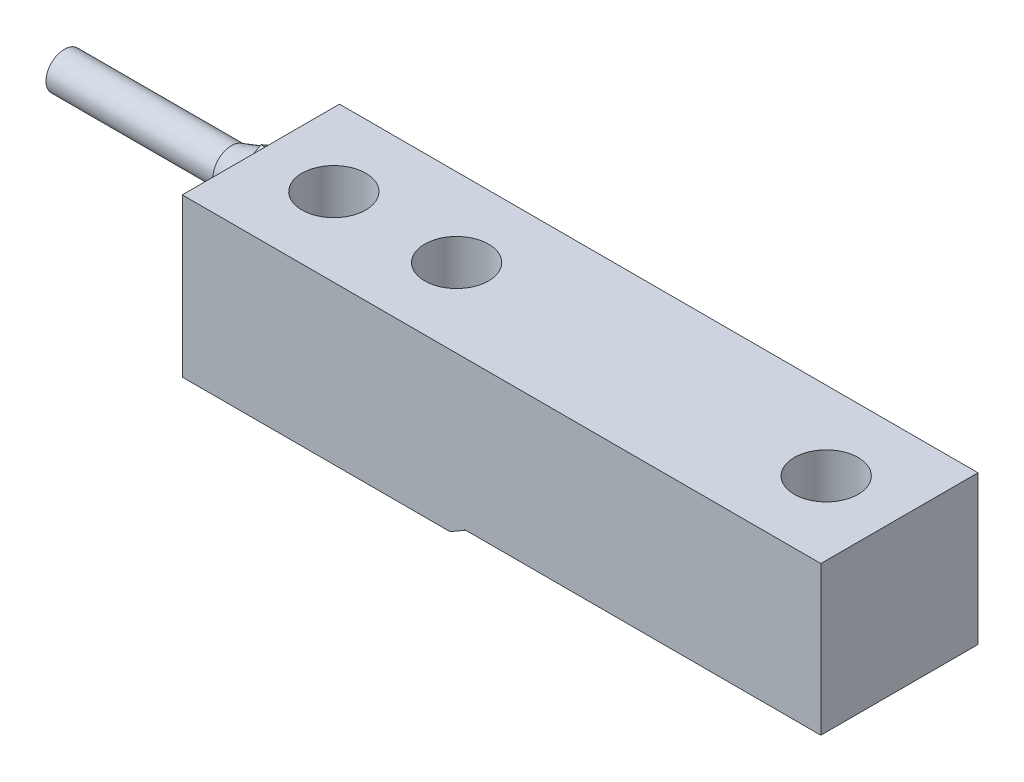
from build123d import *

# Parameters (mm, degrees)
SKETCH1_W                     = 130
SKETCH1_H                     = 32
BOSS_EXTRUDE1_DEPTH           = 32.131
SKETCH2_R                     = 6.5
CUT_EXTRUDE1_DEPTH            = 138.68224708
SKETCH3_R                     = 6.5
CUT_EXTRUDE2_DEPTH            = 12
TAP_DRILL_FOR_M12X1_75_TAP1_D = 10.2
CUT_EXTRUDE3_START            = -32.131
SKETCH10_W                    = 72.5
SKETCH10_H                    = 32
CUT_EXTRUDE3_DEPTH            = 1.85
CHAMFER1_SIZE                 = 3
CHAMFER1_SIZE2                = 1.732050808
BOSS_EXTRUDE2_DEPTH           = 10
SKETCH13_W                    = 1
SKETCH13_H                    = 1


with BuildPart() as part:
    # Sketch1 → Boss-Extrude1 (new body)
    with BuildSketch(Plane(origin=(0, 0, 0), x_dir=(1, 0, 0), z_dir=(0, 1, 0))):
        with Locations((65, 16)):
            Rectangle(SKETCH1_W, SKETCH1_H)
    extrude(amount=BOSS_EXTRUDE1_DEPTH)

    # Sketch2 → Cut-Extrude1 (cut, through all)
    with BuildSketch(Plane(origin=(0, 32.131, 0), x_dir=(1, 0, 0), z_dir=(0, 1, 0))):
        with Locations(Location((14.85, 16, 0), (0, 0, 270))):
            Circle(SKETCH2_R)
        with Locations(Location((39.85, 16, 0), (0, 0, 270))):
            Circle(SKETCH2_R)
    extrude(amount=-CUT_EXTRUDE1_DEPTH, mode=Mode.SUBTRACT)

    # Sketch3 → Cut-Extrude2 (cut)
    with BuildSketch(Plane(origin=(0, 32.131, 0), x_dir=(1, 0, 0), z_dir=(0, 1, 0))):
        with Locations(Location((115.1, 16, 0), (0, 0, 270))):
            Circle(SKETCH3_R)
    extrude(amount=-CUT_EXTRUDE2_DEPTH, mode=Mode.SUBTRACT)

    # Tap Drill for M12x1.75 Tap1 (through all)
    with Locations(Plane(origin=(0, 20.131, 0), x_dir=(1, 0, 0), z_dir=(0, 1, 0))):
        with Locations((115.1, 16)):
            Hole(TAP_DRILL_FOR_M12X1_75_TAP1_D / 2)

    # Sketch10 → Cut-Extrude3 (cut)
    with BuildSketch(Plane(origin=(0, 32.131, 0), x_dir=(1, 0, 0), z_dir=(0, 1, 0)).offset(CUT_EXTRUDE3_START)):
        with Locations((93.75, 16)):
            Rectangle(SKETCH10_W, SKETCH10_H)
    extrude(amount=CUT_EXTRUDE3_DEPTH, mode=Mode.SUBTRACT)

    # Chamfer1
    chamfer1_edges = [part.edges().sort_by_distance(p)[0] for p in [
        (57.5, 0, -16),
    ]]
    chamfer1_side = [part.faces().sort_by_distance(p)[0] for p in [
        (28.986038139, 0, -16),
    ]]
    chamfer(chamfer1_edges, length=CHAMFER1_SIZE, length2=CHAMFER1_SIZE2, reference=chamfer1_side[0])

    # Sketch12 → Boss-Extrude2 (add)
    with BuildSketch(Plane.ZY):
        Polygon((-20, 12.601398385), (-20, 19.529601615), (-26, 22.99370323), (-32, 19.529601615), (-32, 12.601398385), (-26, 9.13729677), align=None)
    extrude(amount=BOSS_EXTRUDE2_DEPTH)

    # Sketch13 → Cut-Revolve1 (revolve, cut)
    with BuildSketch(Plane.XY.offset(-26)):
        with Locations((-0.5, 22.49370323)):
            Rectangle(SKETCH13_W, SKETCH13_H)
        with Locations((-5.5, 22.49370323)):
            Rectangle(SKETCH13_W, SKETCH13_H)
    revolve(axis=Axis((0, 16.0655, -26), (-1, 0, 0)), mode=Mode.SUBTRACT)

    # Sketch14 → Revolve2 (revolve)
    with BuildSketch(Plane.XY.offset(-26), mode=Mode.PRIVATE) as revolve2_sk:
        Polygon((-10, 21.8155), (-16, 19.8155), (-50, 19.8155), (-50, 16.0655), (-10, 16.0655), align=None)
    revolve(revolve2_sk.sketch.rotate(Axis((-50, 16.0655, -26), (1, 0, 0)), 90), axis=Axis((-50, 16.0655, -26), (1, 0, 0)))


solid = part.part
